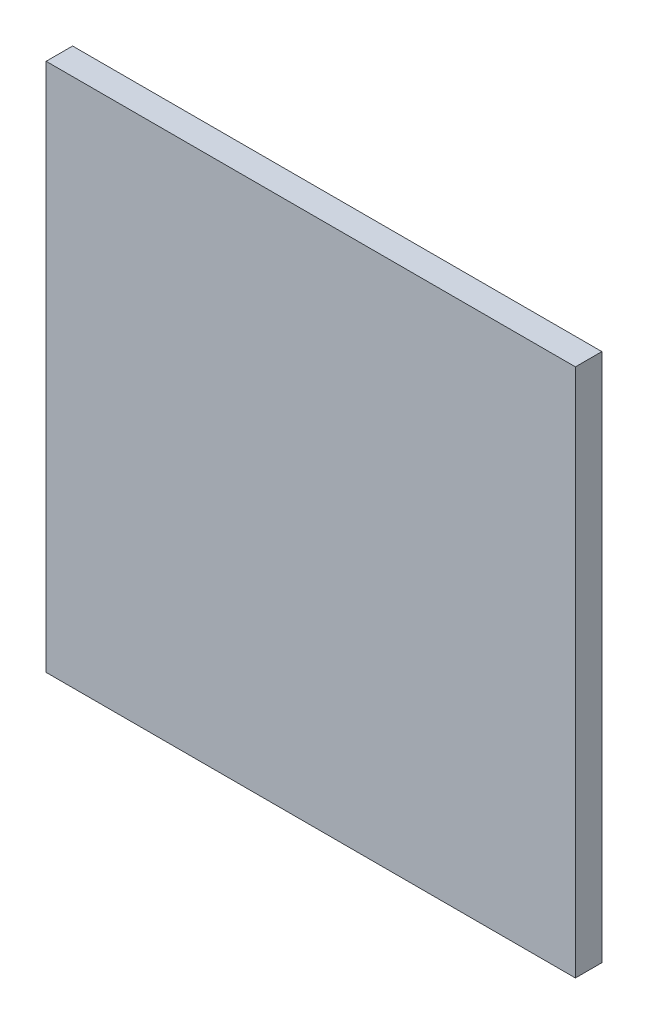
from build123d import *

# Parameters (mm, degrees)
ESQUISSE1_W        = 63.5
ESQUISSE1_H        = 63.5
BOSS_EXTRU_1_DEPTH = 3.175


with BuildPart() as part:
    # Esquisse1 → Boss.-Extru.1 (new body)
    with BuildSketch(Plane.XY):
        Rectangle(ESQUISSE1_W, ESQUISSE1_H)
    extrude(amount=BOSS_EXTRU_1_DEPTH)


solid = part.part
